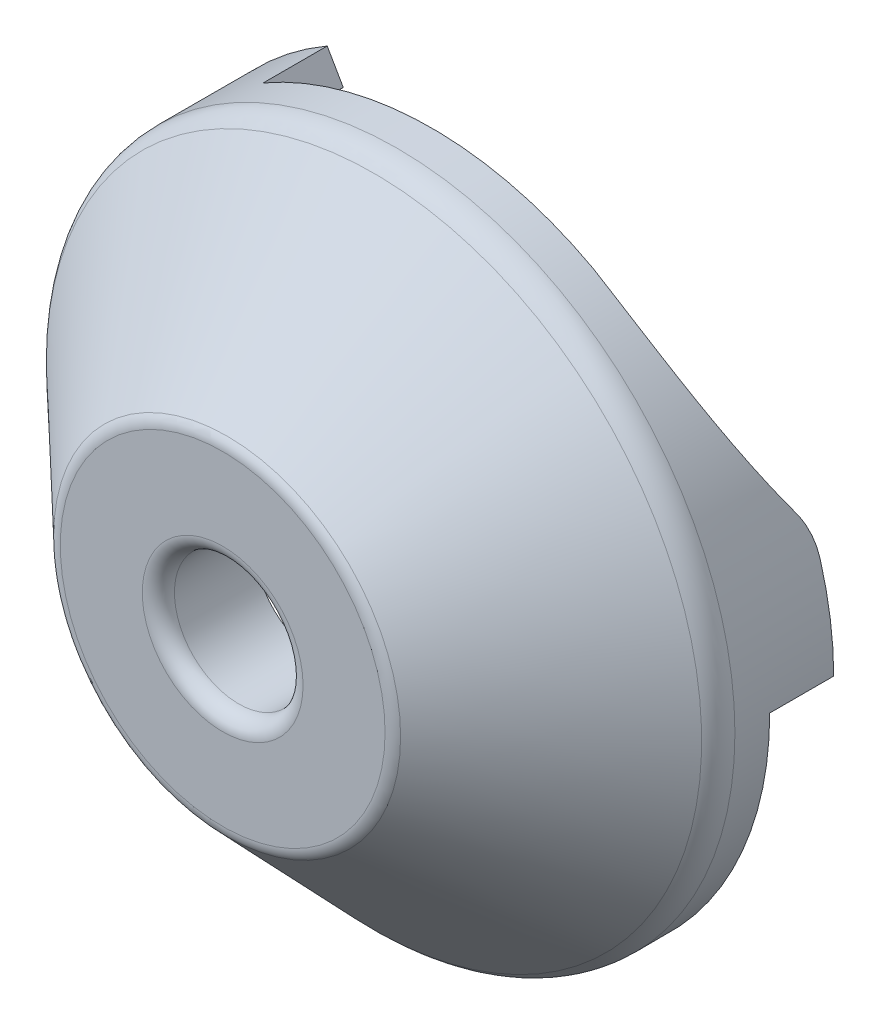
from build123d import *

# Parameters (mm, degrees)
ESQUISSE1_R                  = 5
ESQUISSE1_R_2                = 4
BASE_EXTRUSION_DEPTH         = 4
ESQUISSE2_R                  = 10.5
ESQUISSE2_R_2                = 4
BOSS_EXTRU_1_DEPTH           = 2
ENL_V_MAT_EXTRU_1_DEPTH      = 32.670175244
R_P_TITION_CIRCULAIRE1_COUNT = 3
CONG_1_R                     = 5
CONG_2_R                     = 1


with BuildPart() as part:
    # Esquisse1 → Base-Extrusion (new body)
    with BuildSketch(Plane.XY):
        Circle(ESQUISSE1_R)
        Circle(ESQUISSE1_R_2, mode=Mode.SUBTRACT)
    extrude(amount=BASE_EXTRUSION_DEPTH)

    # Esquisse2 → Boss.-Extru.1 (add)
    with BuildSketch(Plane.XY.offset(4)):
        Circle(ESQUISSE2_R)
        Circle(ESQUISSE2_R_2, mode=Mode.SUBTRACT)
    extrude(amount=BOSS_EXTRU_1_DEPTH)

    # Esquisse3 → Boss.-Révol.1 (revolve)
    with BuildSketch(Plane(origin=(0, 0, 0), x_dir=(1, 0, 0), z_dir=(0, 1, 0))):
        with BuildLine():
            Line((-10.5, -6), (-20.379310345, 3.408866995))
            ThreePointArc((-20.379310345, 3.408866995), (-20.83829006, 4.06930426), (-21, 4.857142857))
            Line((-21, 4.857142857), (-21, 6))
            Line((-21, 6), (-21, 11))
            Line((-21, 11), (-19, 11))
            Line((-19, 11), (-19, 5.5))
            ThreePointArc((-19, 5.5), (-18.851832131, 4.744541358), (-18.429282241, 4.101017414))
            Line((-18.429282241, 4.101017414), (-10.5, -4))
            Line((-10.5, -4), (-10.5, -6))
        make_face()
    revolve(axis=Axis((0, 0, -19.062079538), (0, 0, 1)))

    # Esquisse4 → Enlèv. mat.-Extru.1 (cut, through all)
    with BuildSketch(Plane(origin=(0, 0, 0), x_dir=(1, 0, 0), z_dir=(0, 1, 0))):
        with BuildLine():
            Line((11.003277804, 7.020139439), (23.595787982, 7.020139439))
            Line((23.595787982, 7.020139439), (23.595787982, 11.020139439))
            ThreePointArc((23.595787982, 11.020139439), (2.431434716, 55.826808841), (11.003277804, 7.020139439))
        make_face()
    enl_v_mat_extru_1 = extrude(amount=-ENL_V_MAT_EXTRU_1_DEPTH, mode=Mode.SUBTRACT)

    # Répétition circulaire1: Enlèv. mat.-Extru.1 ×3 about axis
    r_p_tition_circulaire1_axis = Axis((0, 0, -50), (0, 0, 1))
    for i in range(1, R_P_TITION_CIRCULAIRE1_COUNT):
        add(enl_v_mat_extru_1.rotate(r_p_tition_circulaire1_axis, i * 360 / R_P_TITION_CIRCULAIRE1_COUNT), mode=Mode.SUBTRACT)

    # Congé1
    cong_1_edges = [part.edges().sort_by_distance(p)[0] for p in [
        (-15.260123677, 12.926551295, -11),
        (-3.564659966, -19.678930416, -11),
        (18.824783643, 6.752379122, -11),
    ]]
    fillet(cong_1_edges, radius=CONG_1_R)

    # Congé2
    cong_2_edges = [part.edges().sort_by_distance(p)[0] for p in [
        (10.5, 0, 6),
        (-4, 0, 6),
    ]]
    fillet(cong_2_edges, radius=CONG_2_R)


solid = part.part
